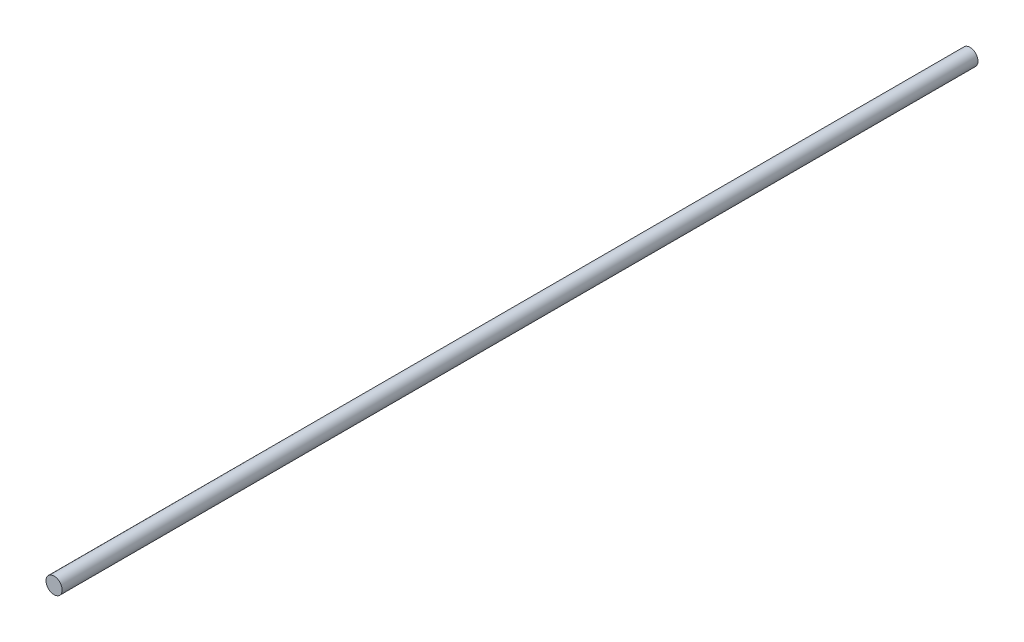
from build123d import *

# Parameters (mm, degrees)
SKETCH1_R           = 6
BOSS_EXTRUDE1_DEPTH = 680


with BuildPart() as part:
    # Sketch1 → Boss-Extrude1 (new body)
    with BuildSketch(Plane.XY):
        Circle(SKETCH1_R)
    extrude(amount=BOSS_EXTRUDE1_DEPTH)


solid = part.part
